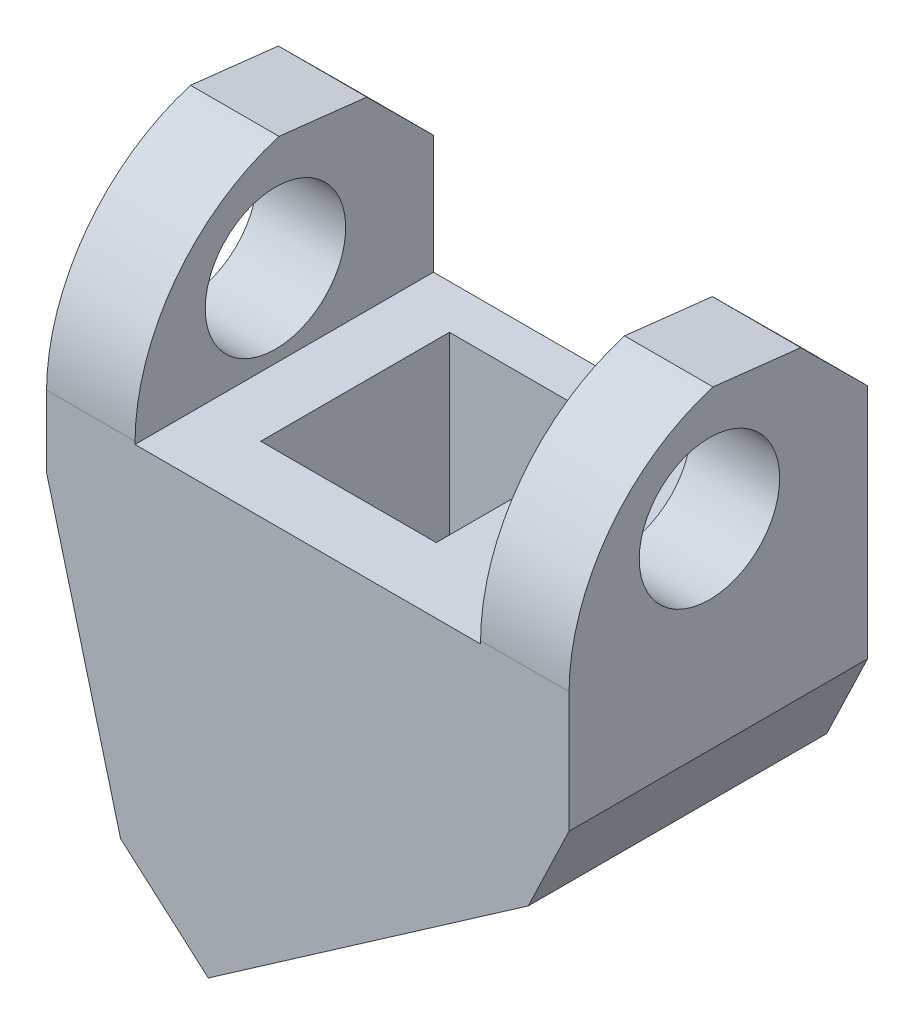
from build123d import *

# Parameters (mm, degrees)
BOSS_EXTRUDE1_DEPTH     = 17
CUT_EXTRUDE3_DEPTH      = 27
CUT_EXTRUDE3_DEPTH_BACK = 17
SKETCH5_W               = 9.47
SKETCH5_H               = 10.75
CUT_EXTRUDE4_REACH      = 35.912
SKETCH7_W               = 10
SKETCH7_H               = 10.75
SKETCH8_R               = 4
CUT_EXTRUDE5_DEPTH      = 37


with BuildPart() as part:
    # Sketch1 → Boss-Extrude1 (new body)
    with BuildSketch(Plane.XY):
        Polygon((-13.217142857, 28.337142857), (-8.177142857, 28.337142857), (-8.177142857, 17.237142857), (11.505594759, 17.237142857), (11.505594759, 28.337142857), (16.545594759, 28.337142857), (16.545594759, 10.516618894), (14.225387594, 5.673733524), (-4.003880739, -6.9964589), (-9, -2.622857143), (-13.217142857, 13.337142857), align=None)
    extrude(amount=BOSS_EXTRUDE1_DEPTH)

    # Sketch4 → Cut-Extrude3 (cut, two sides: drawn at the far end of the back side and taken through both)
    with BuildSketch(Plane(origin=(-8.177142857, 0, 0), x_dir=(0, 0, -1), z_dir=(1, 0, 0)).offset(-CUT_EXTRUDE3_DEPTH_BACK)):
        with BuildLine():
            Line((-17, 28.337142857), (-17, 17.4025989))
            ThreePointArc((-17, 17.4025989), (-14.6995428, 24.220877118), (-8.797223125, 28.337142857))
            Line((-8.797223125, 28.337142857), (-17, 28.337142857))
        make_face()
        Polygon((-3.797223125, 27.774535639), (0, 23.997142857), (0, 28.337142857), (-8.797223125, 28.337142857), align=None)
    extrude(amount=CUT_EXTRUDE3_DEPTH + CUT_EXTRUDE3_DEPTH_BACK, mode=Mode.SUBTRACT)

    # Cut-Sweep1: sweep along a path in Sketch6
    with BuildLine(Plane.XY.offset(10)) as cut_sweep1_path:
        Line((0.85151547, -3.621731888), (-5.920332926, 2.306342783))
    # Sketch5 → Cut-Sweep1 (sweep, cut)
    with BuildSketch(Plane(origin=(1.974682223, -2.841078565, 0), x_dir=(0.8211382131865097, 0.5707293884538155, 0), z_dir=(0.5707293884538155, -0.8211382131865098, 0))):
        with Locations((1.454175815, 7.885)):
            Rectangle(SKETCH5_W, SKETCH5_H)
    sweep(path=cut_sweep1_path.line, mode=Mode.SUBTRACT)

    # Cut-Extrude4: up to this face of the body (flat: up to its plane)
    cut_extrude4_end = Plane(part.part.faces().sort_by_distance((-4.105252084, -1.749504011, 7.885))[0])
    # Sketch7 → Cut-Extrude4 (cut, up to the picked face)
    with BuildSketch(Plane(origin=(0, 17.237142857, 0), x_dir=(1, 0, 0), z_dir=(0, 1, 0)), mode=Mode.PRIVATE) as cut_extrude4_sk1:
        with Locations((0.242857143, -7.885)):
            Rectangle(SKETCH7_W, SKETCH7_H)
    cut_extrude4_tool1 = split(extrude(cut_extrude4_sk1.sketch, amount=-CUT_EXTRUDE4_REACH, mode=Mode.PRIVATE), bisect_by=cut_extrude4_end, keep=Keep.BOTH, mode=Mode.PRIVATE)
    add(cut_extrude4_tool1.solids().sort_by(Axis((0.242857, 17.237143, 7.885), (0, -1, 0)))[0], mode=Mode.SUBTRACT)

    # Sketch8 → Cut-Extrude5 (cut)
    with BuildSketch(Plane.ZY.offset(13.217142857)):
        with Locations(Location((9, 21.937142857, 0), (0, 0, 90))):
            Circle(SKETCH8_R)
    extrude(amount=-CUT_EXTRUDE5_DEPTH, mode=Mode.SUBTRACT)


solid = part.part
